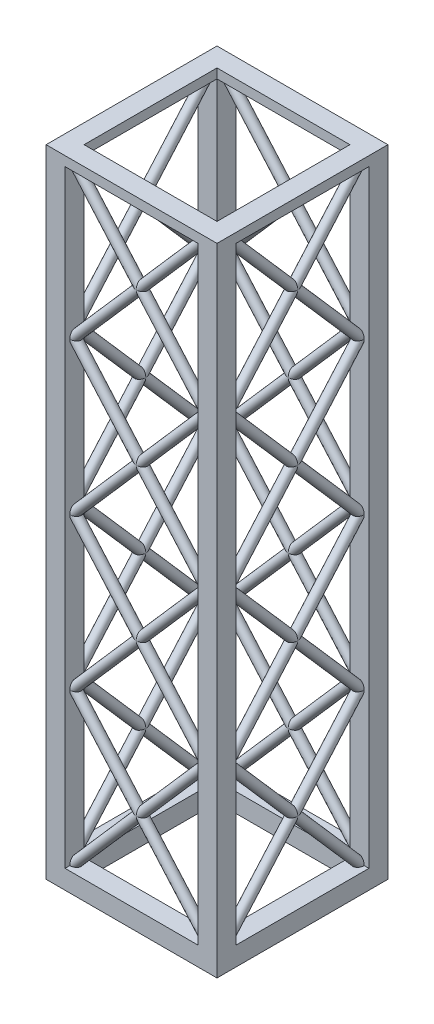
from build123d import *

# Parameters (mm, degrees)
SKETCH1_W           = 90
SKETCH1_H           = 90
SKETCH1_W_2         = 70
SKETCH1_H_2         = 70
BOSS_EXTRUDE2_DEPTH = 10
SKETCH2_W           = 10
SKETCH2_H           = 10
BOSS_EXTRUDE3_DEPTH = 320
CIRPATTERN2_COUNT   = 4
SKETCH3_W           = 90
SKETCH3_H           = 90
SKETCH3_W_2         = 70
SKETCH3_H_2         = 70
BOSS_EXTRUDE4_DEPTH = 5
LPATTERN1_COUNT     = 4
LPATTERN1_PITCH     = 80
CIRPATTERN3_COUNT   = 4


with BuildPart() as part:
    # Sketch1 → Boss-Extrude2 (new body)
    with BuildSketch(Plane(origin=(0, 0, 0), x_dir=(1, 0, 0), z_dir=(0, 1, 0))):
        Rectangle(SKETCH1_W, SKETCH1_H)
        Rectangle(SKETCH1_W_2, SKETCH1_H_2, mode=Mode.SUBTRACT)
    extrude(amount=BOSS_EXTRUDE2_DEPTH)

    # Sketch2 → Boss-Extrude3 (add)
    with BuildSketch(Plane(origin=(0, 10, 0), x_dir=(1, 0, 0), z_dir=(0, 1, 0))):
        with Locations((-40, -40)):
            Rectangle(SKETCH2_W, SKETCH2_H)
    boss_extrude3 = extrude(amount=BOSS_EXTRUDE3_DEPTH)

    # CirPattern2: Boss-Extrude3 ×4 about axis
    cirpattern2_axis = Axis((0, 0, 0), (0, 1, 0))
    for i in range(1, CIRPATTERN2_COUNT):
        add(boss_extrude3.rotate(cirpattern2_axis, i * 360 / CIRPATTERN2_COUNT))

    # Sketch3 → Boss-Extrude4 (add)
    with BuildSketch(Plane(origin=(0, 330, 0), x_dir=(1, 0, 0), z_dir=(0, 1, 0))):
        Rectangle(SKETCH3_W, SKETCH3_H)
        Rectangle(SKETCH3_W_2, SKETCH3_H_2, mode=Mode.SUBTRACT)
    extrude(amount=BOSS_EXTRUDE4_DEPTH)

    # Sketch4 → Revolve-Thin1 (revolve)
    with BuildSketch(Plane(origin=(0, 0, 40), x_dir=(-1, 0, 0), z_dir=(0, 0, -1)), mode=Mode.PRIVATE) as revolve_thin1_sk:
        Polygon((-35, 10), (35, 90.055314444), (33.117994493, 91.700931432), (-36.882005507, 11.645616988), align=None)
    revolve_thin1 = revolve(revolve_thin1_sk.sketch.rotate(Axis((35, 10, 40), (-0.6582467953973894, 0.7528022026728318, 0)), 270), axis=Axis((35, 10, 40), (-0.6582467953973894, 0.7528022026728318, 0)))

    # Mirror1: Revolve-Thin1 across plane
    add(revolve_thin1.mirror(Plane(origin=(0, 0, 0), x_dir=(0, 0, 1), z_dir=(1, 0, 0))))

    # LPattern1: Revolve-Thin1 ×4
    with Locations(*[(0, i * LPATTERN1_PITCH, 0) for i in range(1, LPATTERN1_COUNT)]):
        add(revolve_thin1)

    # LPattern1 copy 1 sketch → LPattern1 copy 1 (revolve)
    with BuildSketch(Plane(origin=(0, 80, 40), x_dir=(1, 0, 0), z_dir=(0, 0, -1))):
        Polygon((-35, -10), (35, -90.055314444), (33.117994493, -91.700931432), (-36.882005507, -11.645616988), align=None)
    revolve(axis=Axis((-35, 90, 40), (-0.6582467953973894, -0.7528022026728318, 0)))

    # LPattern1 copy 2 sketch → LPattern1 copy 2 (revolve)
    with BuildSketch(Plane(origin=(0, 160, 40), x_dir=(1, 0, 0), z_dir=(0, 0, -1))):
        Polygon((-35, -10), (35, -90.055314444), (33.117994493, -91.700931432), (-36.882005507, -11.645616988), align=None)
    revolve(axis=Axis((-35, 170, 40), (-0.6582467953973894, -0.7528022026728318, 0)))

    # LPattern1 copy 3 sketch → LPattern1 copy 3 (revolve)
    with BuildSketch(Plane(origin=(0, 240, 40), x_dir=(1, 0, 0), z_dir=(0, 0, -1))):
        Polygon((-35, -10), (35, -90.055314444), (33.117994493, -91.700931432), (-36.882005507, -11.645616988), align=None)
    revolve(axis=Axis((-35, 250, 40), (-0.6582467953973894, -0.7528022026728318, 0)))

    # CirPattern3: Revolve-Thin1 ×4 about axis
    cirpattern3_axis = Axis((0, 0, 0), (0, 1, 0))
    for i in range(1, CIRPATTERN3_COUNT):
        add(revolve_thin1.rotate(cirpattern3_axis, i * 360 / CIRPATTERN3_COUNT))

    # CirPattern3 copy 1 sketch → CirPattern3 copy 1 (revolve)
    with BuildSketch(Plane(origin=(40, 0, 0), x_dir=(0, 0, -1), z_dir=(-1, 0, 0))):
        Polygon((-35, -10), (35, -90.055314444), (33.117994493, -91.700931432), (-36.882005507, -11.645616988), align=None)
    revolve(axis=Axis((40, 10, 35), (0, -0.7528022026728318, 0.6582467953973894)))

    # CirPattern3 copy 2 sketch → CirPattern3 copy 2 (revolve)
    with BuildSketch(Plane(origin=(0, 0, -40), x_dir=(-1, 0, 0), z_dir=(0, 0, 1))):
        Polygon((-35, -10), (35, -90.055314444), (33.117994493, -91.700931432), (-36.882005507, -11.645616988), align=None)
    revolve(axis=Axis((35, 10, -40), (0.6582467953973894, -0.7528022026728318, 0)))

    # CirPattern3 copy 3 sketch → CirPattern3 copy 3 (revolve)
    with BuildSketch(Plane(origin=(-40, 0, 0), x_dir=(0, 0, 1), z_dir=(1, 0, 0))):
        Polygon((-35, -10), (35, -90.055314444), (33.117994493, -91.700931432), (-36.882005507, -11.645616988), align=None)
    revolve(axis=Axis((-40, 10, -35), (0, -0.7528022026728318, -0.6582467953973894)))

    # CirPattern3 copy 4 sketch → CirPattern3 copy 4 (revolve)
    with BuildSketch(Plane(origin=(40, 80, 0), x_dir=(0, 0, 1), z_dir=(-1, 0, 0))):
        Polygon((-35, 10), (35, 90.055314444), (33.117994493, 91.700931432), (-36.882005507, 11.645616988), align=None)
    revolve(axis=Axis((40, 90, -35), (0, 0.7528022026728318, 0.6582467953973894)))

    # CirPattern3 copy 5 sketch → CirPattern3 copy 5 (revolve)
    with BuildSketch(Plane(origin=(0, 80, -40), x_dir=(1, 0, 0), z_dir=(0, 0, 1))):
        Polygon((-35, 10), (35, 90.055314444), (33.117994493, 91.700931432), (-36.882005507, 11.645616988), align=None)
    revolve(axis=Axis((-35, 90, -40), (0.6582467953973894, 0.7528022026728318, 0)))

    # CirPattern3 copy 6 sketch → CirPattern3 copy 6 (revolve)
    with BuildSketch(Plane(origin=(-40, 80, 0), x_dir=(0, 0, -1), z_dir=(1, 0, 0))):
        Polygon((-35, 10), (35, 90.055314444), (33.117994493, 91.700931432), (-36.882005507, 11.645616988), align=None)
    revolve(axis=Axis((-40, 90, 35), (0, 0.7528022026728318, -0.6582467953973894)))

    # CirPattern3 copy 7 sketch → CirPattern3 copy 7 (revolve)
    with BuildSketch(Plane(origin=(40, 160, 0), x_dir=(0, 0, 1), z_dir=(-1, 0, 0))):
        Polygon((-35, 10), (35, 90.055314444), (33.117994493, 91.700931432), (-36.882005507, 11.645616988), align=None)
    revolve(axis=Axis((40, 170, -35), (0, 0.7528022026728318, 0.6582467953973894)))

    # CirPattern3 copy 8 sketch → CirPattern3 copy 8 (revolve)
    with BuildSketch(Plane(origin=(0, 160, -40), x_dir=(1, 0, 0), z_dir=(0, 0, 1))):
        Polygon((-35, 10), (35, 90.055314444), (33.117994493, 91.700931432), (-36.882005507, 11.645616988), align=None)
    revolve(axis=Axis((-35, 170, -40), (0.6582467953973894, 0.7528022026728318, 0)))

    # CirPattern3 copy 9 sketch → CirPattern3 copy 9 (revolve)
    with BuildSketch(Plane(origin=(-40, 160, 0), x_dir=(0, 0, -1), z_dir=(1, 0, 0))):
        Polygon((-35, 10), (35, 90.055314444), (33.117994493, 91.700931432), (-36.882005507, 11.645616988), align=None)
    revolve(axis=Axis((-40, 170, 35), (0, 0.7528022026728318, -0.6582467953973894)))

    # CirPattern3 copy 10 sketch → CirPattern3 copy 10 (revolve)
    with BuildSketch(Plane(origin=(40, 240, 0), x_dir=(0, 0, 1), z_dir=(-1, 0, 0))):
        Polygon((-35, 10), (35, 90.055314444), (33.117994493, 91.700931432), (-36.882005507, 11.645616988), align=None)
    revolve(axis=Axis((40, 250, -35), (0, 0.7528022026728318, 0.6582467953973894)))

    # CirPattern3 copy 11 sketch → CirPattern3 copy 11 (revolve)
    with BuildSketch(Plane(origin=(0, 240, -40), x_dir=(1, 0, 0), z_dir=(0, 0, 1))):
        Polygon((-35, 10), (35, 90.055314444), (33.117994493, 91.700931432), (-36.882005507, 11.645616988), align=None)
    revolve(axis=Axis((-35, 250, -40), (0.6582467953973894, 0.7528022026728318, 0)))

    # CirPattern3 copy 12 sketch → CirPattern3 copy 12 (revolve)
    with BuildSketch(Plane(origin=(-40, 240, 0), x_dir=(0, 0, -1), z_dir=(1, 0, 0))):
        Polygon((-35, 10), (35, 90.055314444), (33.117994493, 91.700931432), (-36.882005507, 11.645616988), align=None)
    revolve(axis=Axis((-40, 250, 35), (0, 0.7528022026728318, -0.6582467953973894)))

    # CirPattern3 copy 13 sketch → CirPattern3 copy 13 (revolve)
    with BuildSketch(Plane(origin=(40, 80, 0), x_dir=(0, 0, -1), z_dir=(-1, 0, 0))):
        Polygon((-35, -10), (35, -90.055314444), (33.117994493, -91.700931432), (-36.882005507, -11.645616988), align=None)
    revolve(axis=Axis((40, 90, 35), (0, -0.7528022026728318, 0.6582467953973894)))

    # CirPattern3 copy 14 sketch → CirPattern3 copy 14 (revolve)
    with BuildSketch(Plane(origin=(0, 80, -40), x_dir=(-1, 0, 0), z_dir=(0, 0, 1))):
        Polygon((-35, -10), (35, -90.055314444), (33.117994493, -91.700931432), (-36.882005507, -11.645616988), align=None)
    revolve(axis=Axis((35, 90, -40), (0.6582467953973894, -0.7528022026728318, 0)))

    # CirPattern3 copy 15 sketch → CirPattern3 copy 15 (revolve)
    with BuildSketch(Plane(origin=(-40, 80, 0), x_dir=(0, 0, 1), z_dir=(1, 0, 0))):
        Polygon((-35, -10), (35, -90.055314444), (33.117994493, -91.700931432), (-36.882005507, -11.645616988), align=None)
    revolve(axis=Axis((-40, 90, -35), (0, -0.7528022026728318, -0.6582467953973894)))

    # CirPattern3 copy 16 sketch → CirPattern3 copy 16 (revolve)
    with BuildSketch(Plane(origin=(40, 160, 0), x_dir=(0, 0, -1), z_dir=(-1, 0, 0))):
        Polygon((-35, -10), (35, -90.055314444), (33.117994493, -91.700931432), (-36.882005507, -11.645616988), align=None)
    revolve(axis=Axis((40, 170, 35), (0, -0.7528022026728318, 0.6582467953973894)))

    # CirPattern3 copy 17 sketch → CirPattern3 copy 17 (revolve)
    with BuildSketch(Plane(origin=(0, 160, -40), x_dir=(-1, 0, 0), z_dir=(0, 0, 1))):
        Polygon((-35, -10), (35, -90.055314444), (33.117994493, -91.700931432), (-36.882005507, -11.645616988), align=None)
    revolve(axis=Axis((35, 170, -40), (0.6582467953973894, -0.7528022026728318, 0)))

    # CirPattern3 copy 18 sketch → CirPattern3 copy 18 (revolve)
    with BuildSketch(Plane(origin=(-40, 160, 0), x_dir=(0, 0, 1), z_dir=(1, 0, 0))):
        Polygon((-35, -10), (35, -90.055314444), (33.117994493, -91.700931432), (-36.882005507, -11.645616988), align=None)
    revolve(axis=Axis((-40, 170, -35), (0, -0.7528022026728318, -0.6582467953973894)))

    # CirPattern3 copy 19 sketch → CirPattern3 copy 19 (revolve)
    with BuildSketch(Plane(origin=(40, 240, 0), x_dir=(0, 0, -1), z_dir=(-1, 0, 0))):
        Polygon((-35, -10), (35, -90.055314444), (33.117994493, -91.700931432), (-36.882005507, -11.645616988), align=None)
    revolve(axis=Axis((40, 250, 35), (0, -0.7528022026728318, 0.6582467953973894)))

    # CirPattern3 copy 20 sketch → CirPattern3 copy 20 (revolve)
    with BuildSketch(Plane(origin=(0, 240, -40), x_dir=(-1, 0, 0), z_dir=(0, 0, 1))):
        Polygon((-35, -10), (35, -90.055314444), (33.117994493, -91.700931432), (-36.882005507, -11.645616988), align=None)
    revolve(axis=Axis((35, 250, -40), (0.6582467953973894, -0.7528022026728318, 0)))

    # CirPattern3 copy 21 sketch → CirPattern3 copy 21 (revolve)
    with BuildSketch(Plane(origin=(-40, 240, 0), x_dir=(0, 0, 1), z_dir=(1, 0, 0))):
        Polygon((-35, -10), (35, -90.055314444), (33.117994493, -91.700931432), (-36.882005507, -11.645616988), align=None)
    revolve(axis=Axis((-40, 250, -35), (0, -0.7528022026728318, -0.6582467953973894)))


solid = part.part
